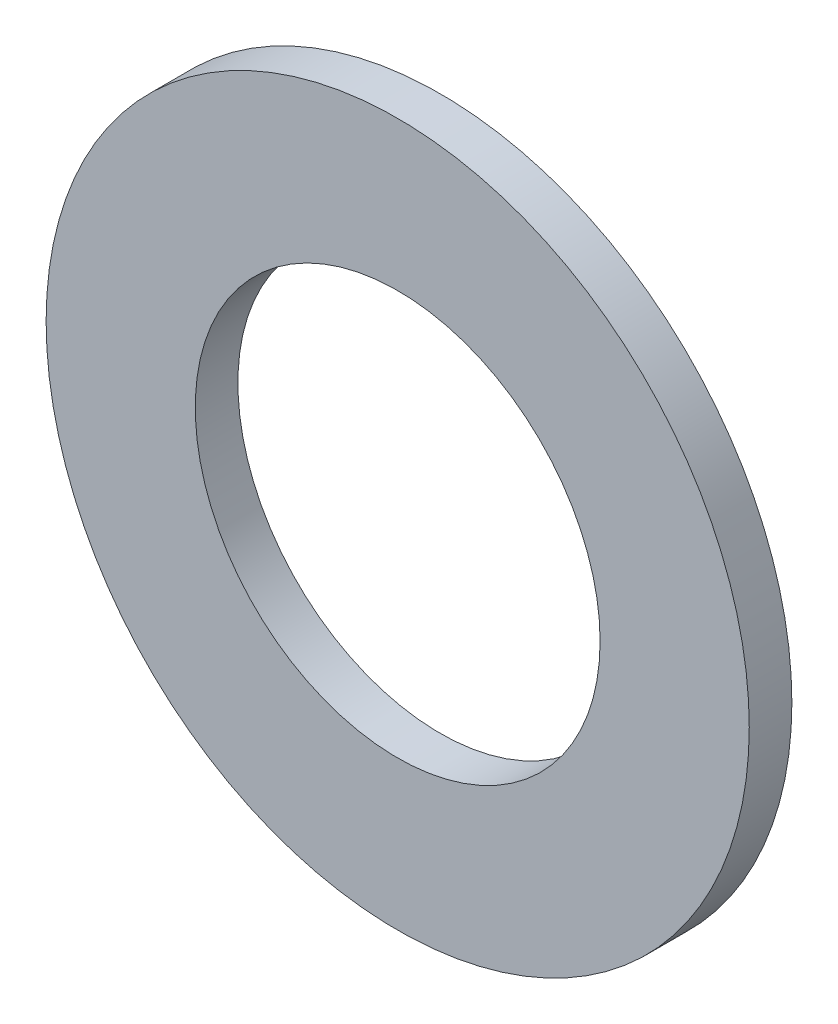
from build123d import *

# Parameters (mm, degrees)
SKETCH1_R      = 16.764
SKETCH1_R_2    = 9.652
EXTRUDE1_DEPTH = 2.032


with BuildPart() as part:
    # Sketch1 → Extrude1 (new body)
    with BuildSketch(Plane.XY):
        Circle(SKETCH1_R)
        Circle(SKETCH1_R_2, mode=Mode.SUBTRACT)
    extrude(amount=-EXTRUDE1_DEPTH)


solid = part.part
